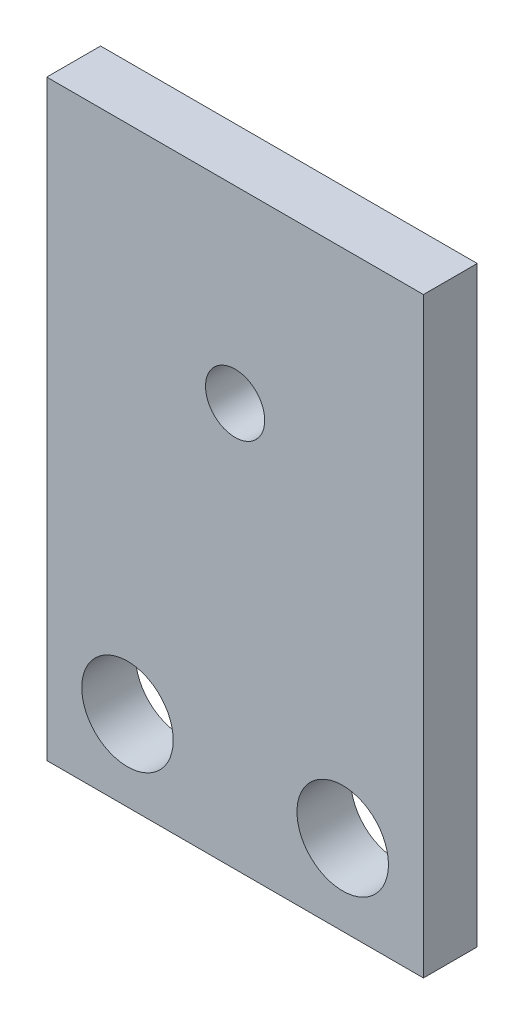
from build123d import *

# Parameters (mm, degrees)
SKETCH_1_W      = 14
SKETCH_1_H      = 22
SKETCH_1_R      = 1.7
SKETCH_1_R_2    = 1.1
EXTRUDE_1_DEPTH = 2


with BuildPart() as part:
    # Эскиз1 → Вытянуть1 (new body)
    with BuildSketch(Plane.XY):
        with Locations((7, 11)):
            Rectangle(SKETCH_1_W, SKETCH_1_H)
        with Locations((3, 3)):
            Circle(SKETCH_1_R, mode=Mode.SUBTRACT)
        with Locations((11, 3)):
            Circle(SKETCH_1_R, mode=Mode.SUBTRACT)
        with Locations((7, 15)):
            Circle(SKETCH_1_R_2, mode=Mode.SUBTRACT)
    extrude(amount=EXTRUDE_1_DEPTH)


solid = part.part
